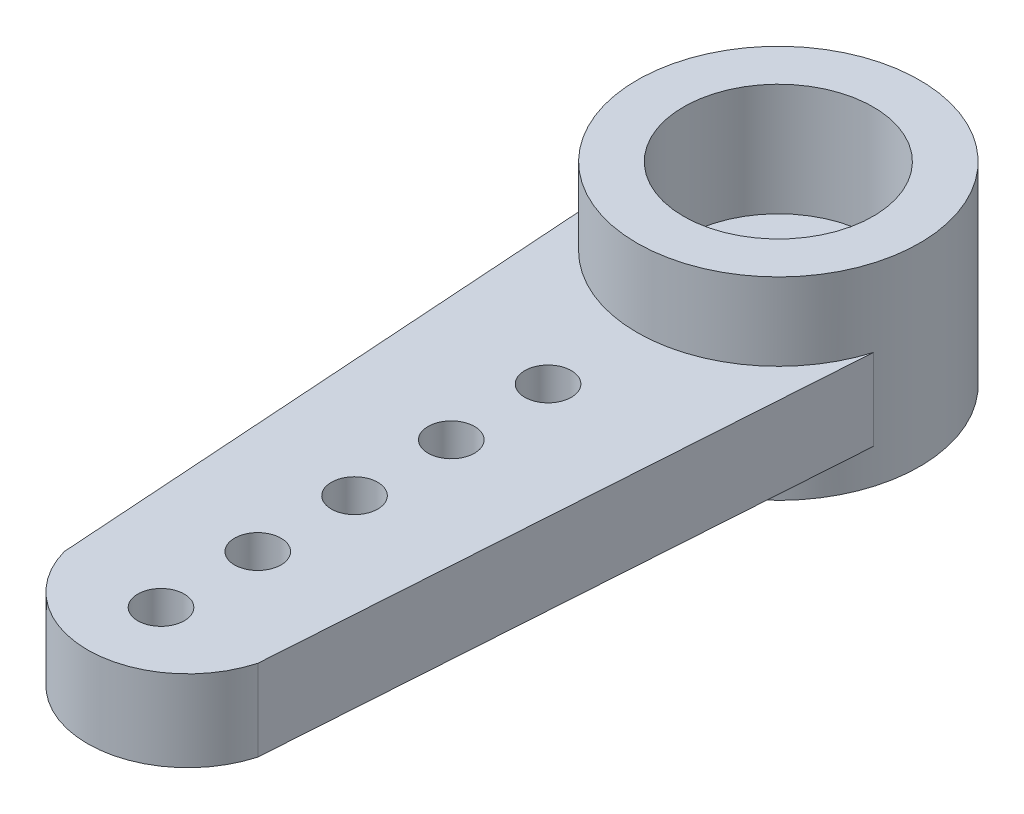
from build123d import *

# Parameters (mm, degrees)
SKETCH_3_R          = 3.65
EXTRUDE_1_DEPTH     = 2.5
SKETCH_4_R          = 2.45
CUT_EXTRUDE_1_DEPTH = 2.9
SKETCH_5_R          = 1.3
CUT_EXTRUDE_2_DEPTH = 6.920726307
EXTRUDE_2_DEPTH     = 2.1
SKETCH_7_R          = 0.6
CUT_EXTRUDE_3_DEPTH = 10


with BuildPart() as part:
    # 草图3 → 凸台-拉伸1 (new, symmetric)
    with BuildSketch(Plane(origin=(0, 0, 0), x_dir=(1, 0, 0), z_dir=(0, 1, 0))):
        with Locations(Location((0, 0, 0), (0, 0, 270))):
            Circle(SKETCH_3_R)
    extrude(amount=EXTRUDE_1_DEPTH, both=True)

    # 草图4 → 切除-拉伸1 (cut)
    with BuildSketch(Plane(origin=(0, 2.5, 0), x_dir=(1, 0, 0), z_dir=(0, 1, 0))):
        with Locations(Location((0, 0, 0), (0, 0, 270))):
            Circle(SKETCH_4_R)
    extrude(amount=-CUT_EXTRUDE_1_DEPTH, mode=Mode.SUBTRACT)

    # 草图5 → 切除-拉伸2 (cut, through all)
    with BuildSketch(Plane(origin=(0, -0.4, 0), x_dir=(1, 0, 0), z_dir=(0, 1, 0))):
        with Locations(Location((0, 0, 0), (0, 0, 270))):
            Circle(SKETCH_5_R)
    extrude(amount=-CUT_EXTRUDE_2_DEPTH, mode=Mode.SUBTRACT)

    # 草图6 → 凸台-拉伸2 (add)
    with BuildSketch(Plane(origin=(0, 0.5, 0), x_dir=(1, 0, 0), z_dir=(0, 1, 0))):
        with BuildLine():
            Line((3.5, -1.035615759), (2.5, -15.95))
            ThreePointArc((2.5, -15.95), (0, -17.85), (-2.5, -15.95))
            Line((-2.5, -15.95), (-3.5, -1.035615759))
            ThreePointArc((-3.5, -1.035615759), (0, -3.65), (3.5, -1.035615759))
        make_face()
    extrude(amount=-EXTRUDE_2_DEPTH)

    # 草图7 → 切除-拉伸3 (cut)
    with BuildSketch(Plane(origin=(0, 0.5, 0), x_dir=(1, 0, 0), z_dir=(0, 1, 0))):
        with Locations(Location((0, -15.95, 0), (0, 0, 270))):
            Circle(SKETCH_7_R)
        with Locations(Location((0, -13.45, 0), (0, 0, 270))):
            Circle(SKETCH_7_R)
        with Locations(Location((0, -10.95, 0), (0, 0, 270))):
            Circle(SKETCH_7_R)
        with Locations(Location((0, -8.45, 0), (0, 0, 270))):
            Circle(SKETCH_7_R)
        with Locations(Location((0, -5.95, 0), (0, 0, 270))):
            Circle(SKETCH_7_R)
    extrude(amount=-CUT_EXTRUDE_3_DEPTH, mode=Mode.SUBTRACT)


solid = part.part
